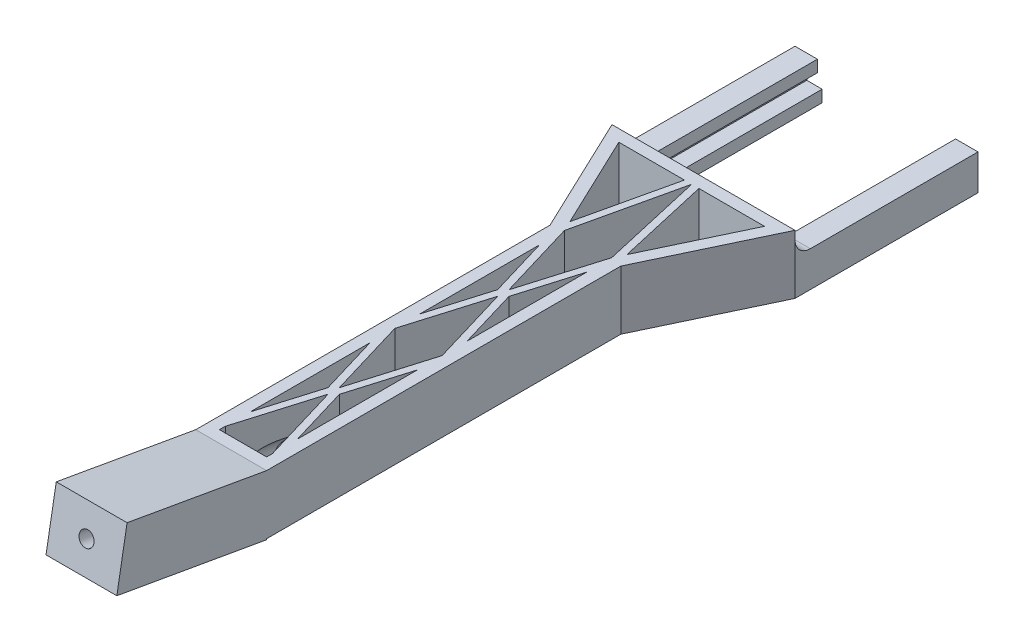
from build123d import *

# Parameters (mm, degrees)
SKETCH1_W           = 39.37
SKETCH1_H           = 39.37
SKETCH1_W_2         = 34.29
SKETCH1_H_2         = 34.29
SKETCH1_H_3         = 2.54
BOSS_EXTRUDE1_DEPTH = 7.62
CUT_EXTRUDE1_START  = 2.54
SKETCH1_4_W         = 34.29
SKETCH1_4_H         = 34.29
SKETCH1_4_H_2       = 2.54
CUT_EXTRUDE1_DEPTH  = 2.54
SKETCH4_W           = 29.718
SKETCH4_H           = 35.052
CUT_EXTRUDE2_DEPTH  = 2.54
SKETCH5_W           = 27.686
SKETCH5_H           = 35.56
CUT_EXTRUDE3_DEPTH  = 2.54
BOSS_EXTRUDE2_START = 5.08
BOSS_EXTRUDE2_DEPTH = 12.7
SKETCH7_W           = 15.24
SKETCH7_H           = 12.7
BOSS_EXTRUDE3_DEPTH = 2.205332
SKETCH7_2_W         = 15.24
SKETCH7_2_H         = 12.7
BOSS_EXTRUDE4_DEPTH = 30.48
CUT_EXTRUDE5_DEPTH  = 173.702638821
CUT_EXTRUDE6_START  = -5.08
SKETCH8_3_R         = 3.81
SKETCH8_3_R_2       = 1.5875
CUT_EXTRUDE6_DEPTH  = 168.622638821
SKETCH9_W           = 10.16
SKETCH9_H           = 27.566743549
CUT_EXTRUDE7_DEPTH  = 10.16
FILLET2_R           = 3.302


with BuildPart() as part:
    # Sketch1 → Boss-Extrude1 (new body)
    # profile 1 of 3: a face of its own
    with BuildSketch(Plane(origin=(0, 0, 0), x_dir=(1, 0, 0), z_dir=(0, 1, 0))):
        Rectangle(SKETCH1_W, SKETCH1_H)
        Rectangle(SKETCH1_W_2, SKETCH1_H_2, mode=Mode.SUBTRACT)
    # profile 2 of 3: a face of its own
    with BuildSketch(Plane(origin=(0, 0, 0), x_dir=(1, 0, 0), z_dir=(0, 1, 0))):
        Rectangle(SKETCH1_W_2, SKETCH1_H_2)
    # profile 3 of 3: a face of its own
    with BuildSketch(Plane(origin=(0, 0, 0), x_dir=(1, 0, 0), z_dir=(0, 1, 0))):
        with Locations((0, 18.415)):
            Rectangle(SKETCH1_W_2, SKETCH1_H_3)
    extrude(amount=BOSS_EXTRUDE1_DEPTH)

    # Sketch1<4> → Cut-Extrude1 (cut)
    with BuildSketch(Plane(origin=(0, 0, 0), x_dir=(1, 0, 0), z_dir=(0, 1, 0)).offset(CUT_EXTRUDE1_START)):
        Rectangle(SKETCH1_4_W, SKETCH1_4_H)
        with Locations((0, 18.415)):
            Rectangle(SKETCH1_4_W, SKETCH1_4_H_2)
    extrude(amount=CUT_EXTRUDE1_DEPTH, mode=Mode.SUBTRACT)

    # Sketch4 → Cut-Extrude2 (cut)
    with BuildSketch(Plane(origin=(0, 7.62, 0), x_dir=(1, 0, 0), z_dir=(0, 1, 0))):
        with Locations((0, 2.159)):
            Rectangle(SKETCH4_W, SKETCH4_H)
    extrude(amount=-CUT_EXTRUDE2_DEPTH, mode=Mode.SUBTRACT)

    # Sketch5 → Cut-Extrude3 (cut)
    with BuildSketch(Plane.XZ):
        with Locations((0, -1.905)):
            Rectangle(SKETCH5_W, SKETCH5_H)
    extrude(amount=-CUT_EXTRUDE3_DEPTH, mode=Mode.SUBTRACT)

    # Sketch6 → Boss-Extrude2 (add)
    with BuildSketch(Plane(origin=(0, 7.62, 0), x_dir=(1, 0, 0), z_dir=(0, 1, 0)).offset(BOSS_EXTRUDE2_START)):
        Polygon((19.685, -19.685), (0, -19.685), (-19.685, -19.685), (-7.62, -45.085), (-7.62, -121.285), (7.62, -121.285), (7.62, -45.085), align=None)
        Polygon((-5.08, -86.330562843), (-1.235077939, -99.234351627), (-5.08, -112.138140412), align=None, mode=Mode.SUBTRACT)
        Polygon((-5.08, -117.475), (0, -100.426215662), (5.08, -117.475), (5.08, -118.745), (-5.08, -118.745), align=None, mode=Mode.SUBTRACT)
        Polygon((1.235077939, -99.234351627), (5.08, -86.330562843), (5.08, -112.138140412), align=None, mode=Mode.SUBTRACT)
        Polygon((0, -98.042487593), (-5.08, -80.993703255), (0, -63.944918917), (5.08, -80.993703255), align=None, mode=Mode.SUBTRACT)
        Polygon((-5.08, -49.849266098), (-1.235077939, -62.753054882), (-5.08, -75.656843666), align=None, mode=Mode.SUBTRACT)
        Polygon((-15.666518092, -22.225), (-1.563086741, -22.225), (-6.136242744, -42.288737575), align=None, mode=Mode.SUBTRACT)
        Polygon((1.235077939, -62.753054882), (5.08, -49.849266098), (5.08, -75.656843666), align=None, mode=Mode.SUBTRACT)
        Polygon((-5.08, -44.51240651), (0, -22.225), (5.08, -44.51240651), (0, -61.561190848), align=None, mode=Mode.SUBTRACT)
        Polygon((6.136242744, -42.288737575), (1.563086741, -22.225), (15.666518092, -22.225), align=None, mode=Mode.SUBTRACT)
    extrude(amount=-BOSS_EXTRUDE2_DEPTH)

    # Sketch7 → Boss-Extrude3 (add)
    with BuildSketch(Plane(origin=(0, 21.1239084, 119.799637666), x_dir=(1, 0, 0), z_dir=(0, 0.17364817766691723, 0.9848077530122104))):
        with Locations((0, -14.903860765)):
            Rectangle(SKETCH7_W, SKETCH7_H)
    extrude(amount=-BOSS_EXTRUDE3_DEPTH)

    # Sketch7<2> → Boss-Extrude4 (add)
    with BuildSketch(Plane(origin=(0, 21.1239084, 119.799637666), x_dir=(1, 0, 0), z_dir=(0, 0.17364817766691723, 0.9848077530122104))):
        with Locations((0, -14.903860765)):
            Rectangle(SKETCH7_2_W, SKETCH7_2_H)
    extrude(amount=BOSS_EXTRUDE4_DEPTH)

    # Sketch8 → Cut-Extrude5 (cut, through all)
    with BuildSketch(Plane(origin=(0, 26.416704855, 149.816577978), x_dir=(1, 0, 0), z_dir=(0, 0.1736481776669177, 0.9848077530122102))):
        with BuildLine():
            ThreePointArc((1.5875, -14.903860765), (0.540425106, -13.411179636), (-1.219551281, -13.887568031))
            Line((-1.219551281, -13.887568031), (1.219551281, -15.9201535))
            ThreePointArc((1.219551281, -15.9201535), (1.49268113, -15.444285871), (1.5875, -14.903860765))
        make_face()
        with BuildLine():
            Line((1.219551281, -15.9201535), (-1.219551281, -13.887568031))
            ThreePointArc((-1.219551281, -13.887568031), (-1.016292734, -16.123412046), (1.219551281, -15.9201535))
        make_face()
    extrude(amount=-CUT_EXTRUDE5_DEPTH, mode=Mode.SUBTRACT)

    # Sketch8<3> → Cut-Extrude6 (cut, through all)
    with BuildSketch(Plane(origin=(0, 26.416704855, 149.816577978), x_dir=(1, 0, 0), z_dir=(0, 0.1736481776669177, 0.9848077530122102)).offset(CUT_EXTRUDE6_START)):
        with Locations(Location((0, -14.903860765, 0), (0, 0, 270))):
            Circle(SKETCH8_3_R)
        with Locations(Location((0, -14.903860765, 0), (0, 0, 270))):
            Circle(SKETCH8_3_R_2, mode=Mode.SUBTRACT)
    extrude(amount=-CUT_EXTRUDE6_DEPTH, mode=Mode.SUBTRACT)

    # Sketch9 → Cut-Extrude7 (cut)
    with BuildSketch(Plane(origin=(0, -20.930966863, 3.69069419), x_dir=(1, 0, 0), z_dir=(0, -0.9848077530122105, 0.1736481776669173))):
        with Locations((0, 130.724368406)):
            Rectangle(SKETCH9_W, SKETCH9_H)
    extrude(amount=-CUT_EXTRUDE7_DEPTH, mode=Mode.SUBTRACT)

    # Fillet2
    fillet2_edges = [part.edges().sort_by_distance(p)[0] for p in [
        (0, 7.62, 19.685),
    ]]
    fillet(fillet2_edges, radius=FILLET2_R)


solid = part.part
